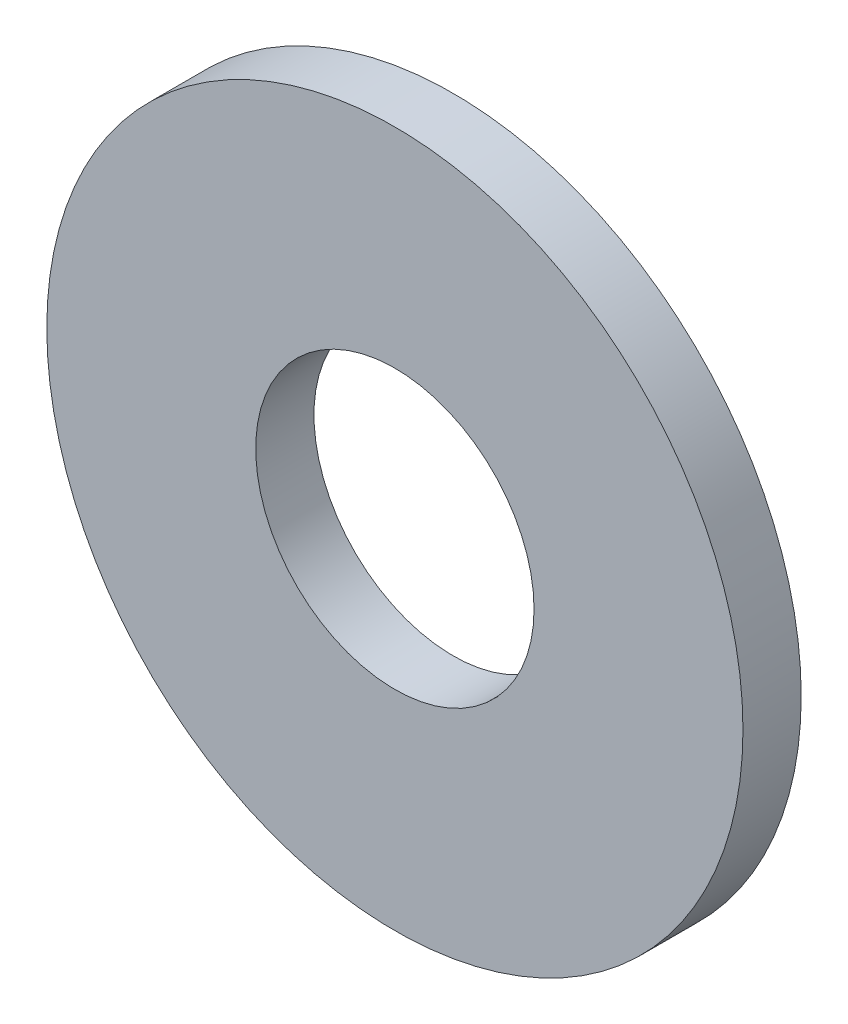
from build123d import *

# Parameters (mm, degrees)
SKETCH1_R           = 37.9603
SKETCH1_R_2         = 15.1765
BOSS_EXTRUDE1_DEPTH = 6.35


with BuildPart() as part:
    # Sketch1 → Boss-Extrude1 (new body)
    with BuildSketch(Plane.XY):
        Circle(SKETCH1_R)
        Circle(SKETCH1_R_2, mode=Mode.SUBTRACT)
    extrude(amount=BOSS_EXTRUDE1_DEPTH)


solid = part.part
